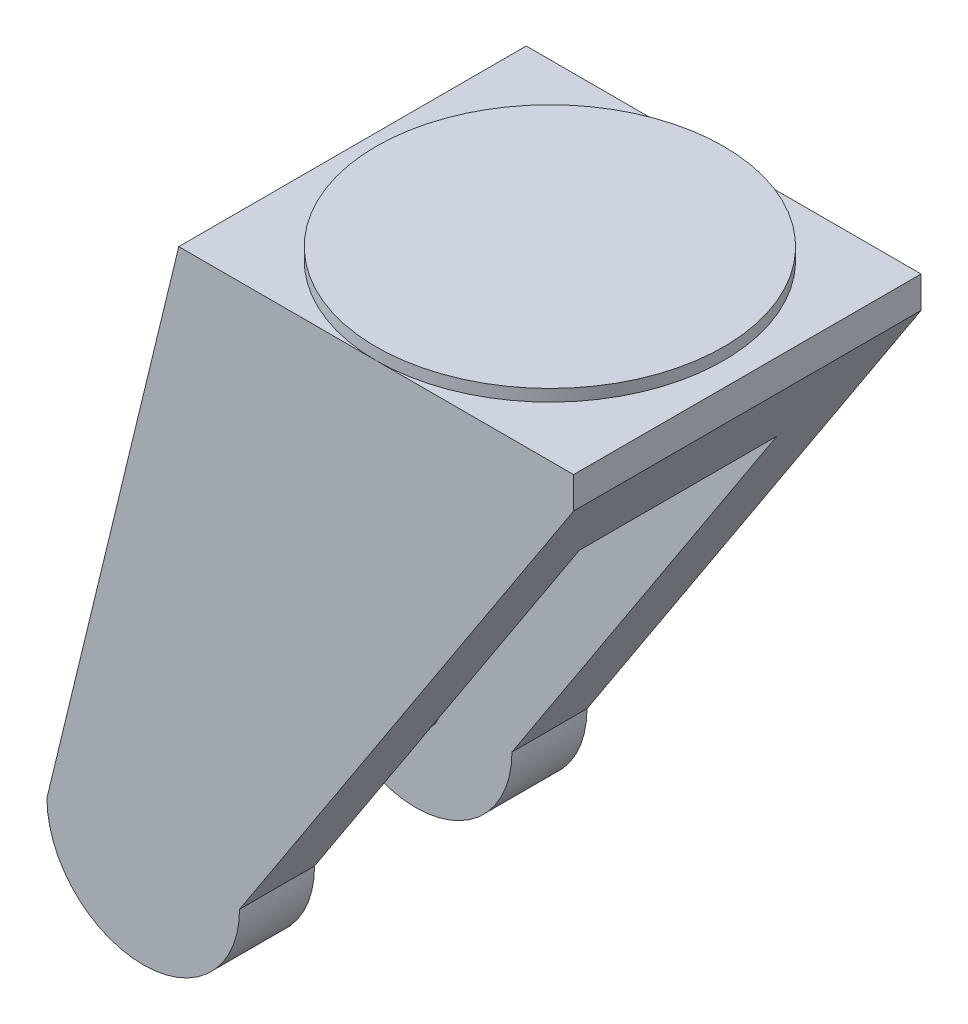
from build123d import *

# Parameters (mm, degrees)
ESTRUSIONE_ESTRUSIONE1_DEPTH  = 88
TAGLIO_ESTRUSIONE2_DEPTH      = 200.184672352
TAGLIO_ESTRUSIONE2_DEPTH_BACK = 200.184672352
SCHIZZO4_R                    = 6.05
ESTRUSIONE_ESTRUSIONE2_DEPTH  = 69
SCHIZZO6_R                    = 44
ESTRUSIONE_ESTRUSIONE3_DEPTH  = 3


with BuildPart() as part:
    # Schizzo1 → Estrusione-Estrusione1 (new body)
    with BuildSketch(Plane.XY):
        with BuildLine():
            Line((-50, 4), (-83.39, -133.65))
            ThreePointArc((-83.39, -133.65), (-59, -158.04), (-34.61, -133.65))
            Line((-34.61, -133.65), (50, -4))
            Line((50, -4), (50, 4))
            Line((50, 4), (-50, 4))
        make_face()
    extrude(amount=ESTRUSIONE_ESTRUSIONE1_DEPTH)

    # Schizzo2 → Taglio-Estrusione2 (cut, two sides: drawn at the far end of the back side and taken through both)
    with BuildSketch(Plane(origin=(0, 0, 0), x_dir=(0, 0, -1), z_dir=(1, 0, 0)).offset(-TAGLIO_ESTRUSIONE2_DEPTH_BACK)):
        Polygon((-69, -45.845), (-69, -245.845), (-19, -245.845), (-19, -45.845), (-19, -30.845), (-69, -30.845), align=None)
    extrude(amount=TAGLIO_ESTRUSIONE2_DEPTH + TAGLIO_ESTRUSIONE2_DEPTH_BACK, mode=Mode.SUBTRACT)

    # Schizzo4 → Estrusione-Estrusione2 (add)
    with BuildSketch(Plane.XY.offset(88)):
        with Locations(Location((-59, -133.65, 0), (0, 0, 270))):
            Circle(SCHIZZO4_R)
    extrude(amount=-ESTRUSIONE_ESTRUSIONE2_DEPTH)

    # Schizzo6 → Estrusione-Estrusione3 (add)
    with BuildSketch(Plane(origin=(0, 4, 0), x_dir=(1, 0, 0), z_dir=(0, 1, 0))):
        with Locations(Location((0, -44, 0), (0, 0, 90))):
            Circle(SCHIZZO6_R)
    extrude(amount=ESTRUSIONE_ESTRUSIONE3_DEPTH)


solid = part.part
